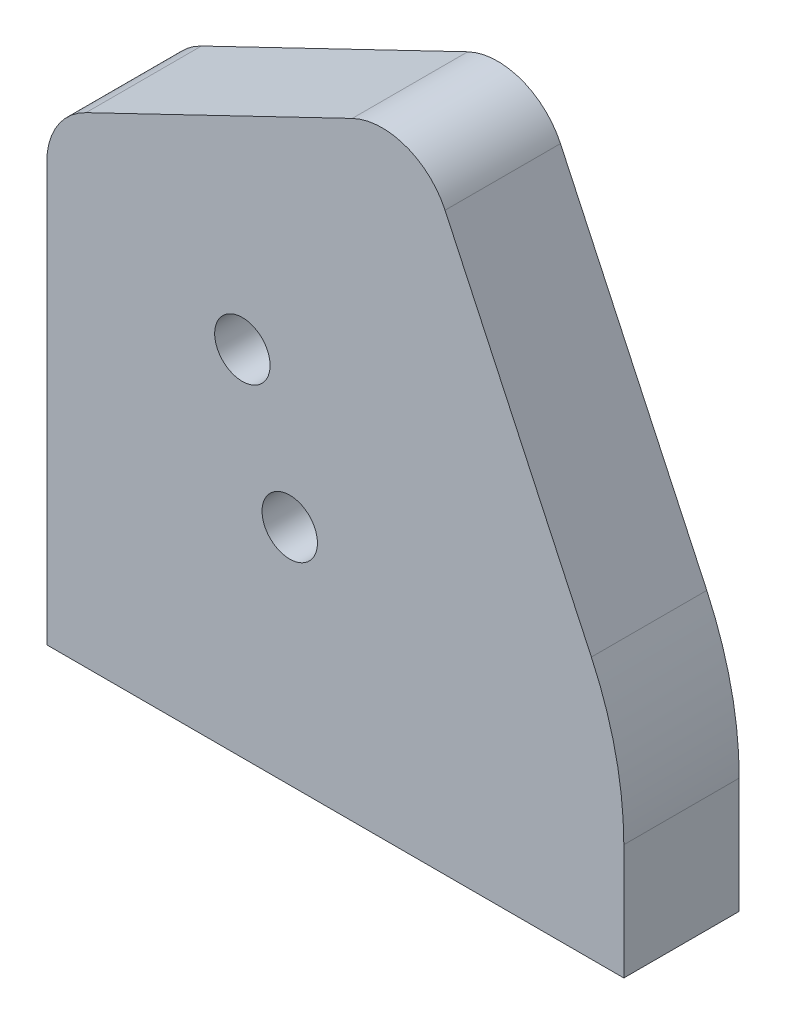
from build123d import *

# Parameters (mm, degrees)
BOSS_EXTRUDE1_DEPTH  = 5
M2_CLEARANCE_HOLE1_D = 2.4
FILLET1_R            = 3


with BuildPart() as part:
    # Sketch1 → Boss-Extrude1 (new body)
    with BuildSketch(Plane.XY):
        with BuildLine():
            Line((-12.5, 17.5), (-12.5, -2.5))
            Line((-12.5, -2.5), (12.5, -2.5))
            Line((12.5, -2.5), (12.5, 2.5))
            ThreePointArc((12.5, 2.5), (12.144440107, 5.746594209), (11.094616806, 8.839273926))
            Line((11.094616806, 8.839273926), (4.755342879, 22.433890732))
            ThreePointArc((4.755342879, 22.433890732), (3.045285311, 23.991312891), (0.735528696, 23.869308605))
            Line((0.735528696, 23.869308605), (-12.5, 17.5))
        make_face()
    extrude(amount=BOSS_EXTRUDE1_DEPTH)

    # M2 Clearance Hole1 (through all)
    with Locations(Plane.XY.offset(5)):
        with Locations((-4.02606043, 12.819077862), (-1.97393957, 7.180922138)):
            Hole(M2_CLEARANCE_HOLE1_D / 2)

    # Fillet1
    fillet1_edges = [part.edges().sort_by_distance(p)[0] for p in [
        (-12.5, 17.5, 2.5),
    ]]
    fillet(fillet1_edges, radius=FILLET1_R)


solid = part.part
